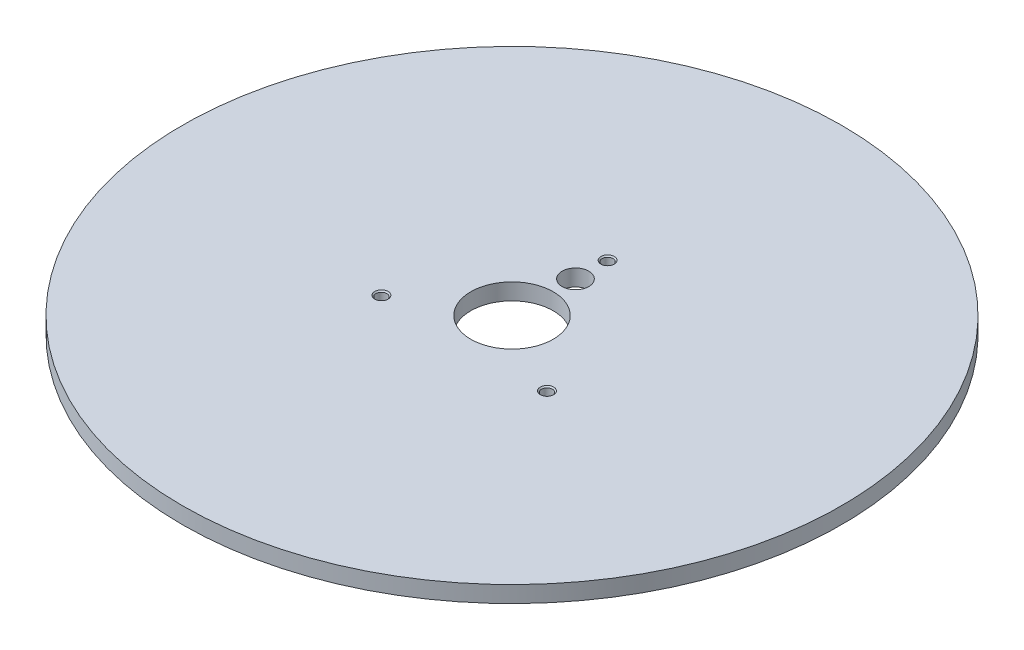
from build123d import *

# Parameters (mm, degrees)
SKETCH_1_R                   = 100
EXTRUDE_1_DEPTH              = 5
CUT_EXTRUDE_1_REACH          = 143.51
SKETCH_2_R                   = 12.5
SKETCH_2_R_2                 = 4.05
HOLE_WIZARD_M4_1_D           = 3.3
HOLE_WIZARD_M4_1_CSINK_D     = 4.05
HOLE_WIZARD_M4_1_CSINK_ANGLE = 90


with BuildPart() as part:
    # 草图1 → 凸台-拉伸1 (new body)
    with BuildSketch(Plane(origin=(0, 0, 0), x_dir=(1, 0, 0), z_dir=(0, 1, 0))):
        with Locations(Location((0, 0, 0), (0, 0, 270))):
            Circle(SKETCH_1_R)
    extrude(amount=EXTRUDE_1_DEPTH)

    # 草图2 → 切除-拉伸1 (cut, up to next)
    with BuildSketch(Plane(origin=(0, 5, 0), x_dir=(1, 0, 0), z_dir=(0, 1, 0)), mode=Mode.PRIVATE) as cut_extrude_1_sk1:
        with Locations(Location((0, 0, 0), (0, 0, 270))):
            Circle(SKETCH_2_R)
    cut_extrude_1_tool1 = extrude(cut_extrude_1_sk1.sketch, amount=-CUT_EXTRUDE_1_REACH, mode=Mode.PRIVATE) & part.part
    # 草图2 → 切除-拉伸1 (cut, up to next)
    with BuildSketch(Plane(origin=(0, 5, 0), x_dir=(1, 0, 0), z_dir=(0, 1, 0)), mode=Mode.PRIVATE) as cut_extrude_1_sk2:
        with Locations(Location((0, 19.25, 0), (0, 0, 270))):
            Circle(SKETCH_2_R_2)
    cut_extrude_1_tool2 = extrude(cut_extrude_1_sk2.sketch, amount=-CUT_EXTRUDE_1_REACH, mode=Mode.PRIVATE) & part.part
    add(cut_extrude_1_tool1.solids().sort_by_distance((0, 5, 0))[0], mode=Mode.SUBTRACT)
    add(cut_extrude_1_tool2.solids().sort_by_distance((0, 5, -19.25))[0], mode=Mode.SUBTRACT)

    # M4 螺纹孔1 (through all)
    with Locations(Plane(origin=(0, 5, 0), x_dir=(1, 0, 0), z_dir=(0, 1, 0))):
        with Locations((25.11473671, -14.5), (0, 29), (-25.11473671, -14.5)):
            CounterSinkHole(HOLE_WIZARD_M4_1_D / 2, HOLE_WIZARD_M4_1_CSINK_D / 2, counter_sink_angle=HOLE_WIZARD_M4_1_CSINK_ANGLE)


solid = part.part
